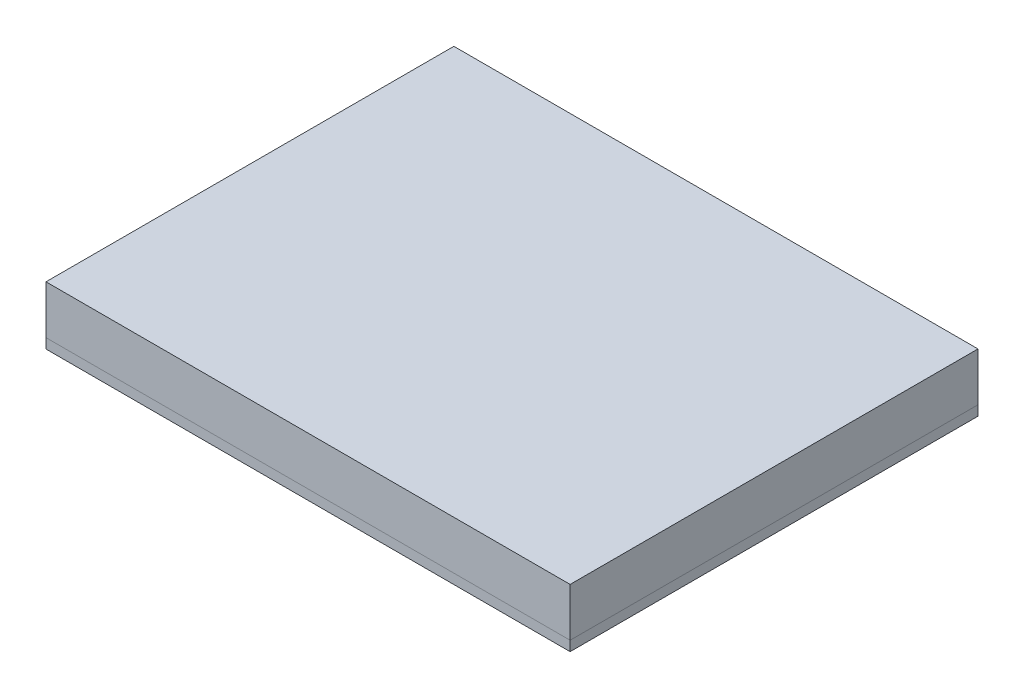
from build123d import *

# Parameters (mm, degrees)
SKETCH1_W           = 89.95
SKETCH1_H           = 70
BOSS_EXTRUDE1_DEPTH = 1.7
BOSS_EXTRUDE2_START = 1.7
SKETCH1_2_W         = 89.95
SKETCH1_2_H         = 70
BOSS_EXTRUDE2_DEPTH = 8.3


with BuildPart() as part:
    # Sketch1 → Boss-Extrude1 (new body)
    with BuildSketch(Plane(origin=(0, 0, 0), x_dir=(1, 0, 0), z_dir=(0, 1, 0))):
        with Locations((44.975, 35)):
            Rectangle(SKETCH1_W, SKETCH1_H)
    extrude(amount=BOSS_EXTRUDE1_DEPTH)


with BuildPart() as body_2:
    # Sketch1<2> → Boss-Extrude2 (new body)
    with BuildSketch(Plane(origin=(0, 0, 0), x_dir=(1, 0, 0), z_dir=(0, 1, 0)).offset(BOSS_EXTRUDE2_START)):
        with Locations((44.975, 35)):
            Rectangle(SKETCH1_2_W, SKETCH1_2_H)
    extrude(amount=BOSS_EXTRUDE2_DEPTH)


solid = Compound([part.part, body_2.part])
